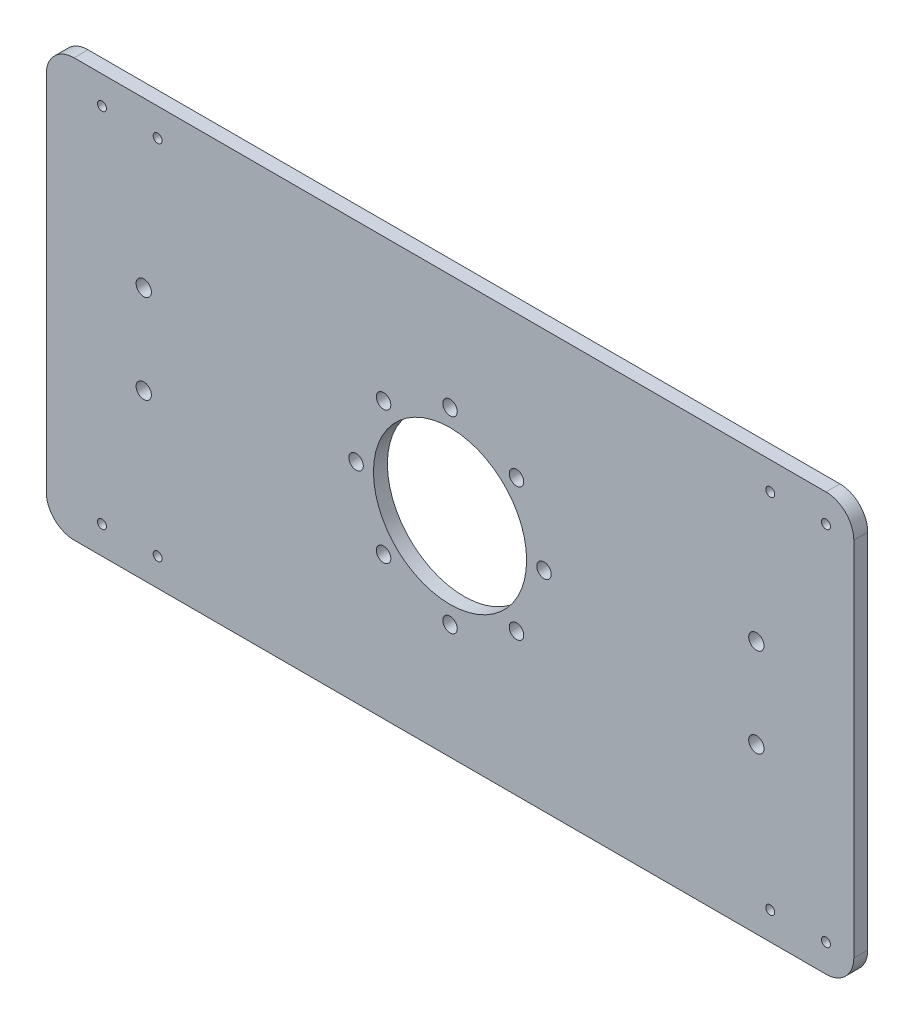
from build123d import *

# Parameters (mm, degrees)
SKETCH_1_W          = 290
SKETCH_1_H          = 150
EXTRUDE_1_DEPTH     = 5
CUT_EXTRUDE_2_REACH = 165.325
SKETCH_5_R          = 27.5
SKETCH_5_R_2        = 2.6
FILLET_1_R          = 10
SKETCH_6_R          = 2.75
CUT_EXTRUDE_3_DEPTH = 10
SKETCH_7_R          = 1.6
CUT_EXTRUDE_4_DEPTH = 10


with BuildPart() as part:
    # 草图1 → 凸台-拉伸1 (new body)
    with BuildSketch(Plane.XY):
        Rectangle(SKETCH_1_W, SKETCH_1_H)
    extrude(amount=EXTRUDE_1_DEPTH)

    # 草图5 → 切除-拉伸2 (cut, up to next)
    with BuildSketch(Plane(origin=(0, 0, 0), x_dir=(-1, 0, 0), z_dir=(0, 0, -1)), mode=Mode.PRIVATE) as cut_extrude_2_sk1:
        Circle(SKETCH_5_R)
    cut_extrude_2_tool1 = extrude(cut_extrude_2_sk1.sketch, amount=-CUT_EXTRUDE_2_REACH, mode=Mode.PRIVATE) & part.part
    # 草图5 → 切除-拉伸2 (cut, up to next)
    with BuildSketch(Plane(origin=(0, 0, 0), x_dir=(-1, 0, 0), z_dir=(0, 0, -1)), mode=Mode.PRIVATE) as cut_extrude_2_sk2:
        with Locations((23.864853865, 23.864853865)):
            Circle(SKETCH_5_R_2)
    cut_extrude_2_tool2 = extrude(cut_extrude_2_sk2.sketch, amount=-CUT_EXTRUDE_2_REACH, mode=Mode.PRIVATE) & part.part
    # 草图5 → 切除-拉伸2 (cut, up to next)
    with BuildSketch(Plane(origin=(0, 0, 0), x_dir=(-1, 0, 0), z_dir=(0, 0, -1)), mode=Mode.PRIVATE) as cut_extrude_2_sk3:
        with Locations((0, 33.75)):
            Circle(SKETCH_5_R_2)
    cut_extrude_2_tool3 = extrude(cut_extrude_2_sk3.sketch, amount=-CUT_EXTRUDE_2_REACH, mode=Mode.PRIVATE) & part.part
    # 草图5 → 切除-拉伸2 (cut, up to next)
    with BuildSketch(Plane(origin=(0, 0, 0), x_dir=(-1, 0, 0), z_dir=(0, 0, -1)), mode=Mode.PRIVATE) as cut_extrude_2_sk4:
        with Locations((-23.864853865, 23.864853865)):
            Circle(SKETCH_5_R_2)
    cut_extrude_2_tool4 = extrude(cut_extrude_2_sk4.sketch, amount=-CUT_EXTRUDE_2_REACH, mode=Mode.PRIVATE) & part.part
    # 草图5 → 切除-拉伸2 (cut, up to next)
    with BuildSketch(Plane(origin=(0, 0, 0), x_dir=(-1, 0, 0), z_dir=(0, 0, -1)), mode=Mode.PRIVATE) as cut_extrude_2_sk5:
        with Locations((-33.75, 0)):
            Circle(SKETCH_5_R_2)
    cut_extrude_2_tool5 = extrude(cut_extrude_2_sk5.sketch, amount=-CUT_EXTRUDE_2_REACH, mode=Mode.PRIVATE) & part.part
    # 草图5 → 切除-拉伸2 (cut, up to next)
    with BuildSketch(Plane(origin=(0, 0, 0), x_dir=(-1, 0, 0), z_dir=(0, 0, -1)), mode=Mode.PRIVATE) as cut_extrude_2_sk6:
        with Locations((-23.864853865, -23.864853865)):
            Circle(SKETCH_5_R_2)
    cut_extrude_2_tool6 = extrude(cut_extrude_2_sk6.sketch, amount=-CUT_EXTRUDE_2_REACH, mode=Mode.PRIVATE) & part.part
    # 草图5 → 切除-拉伸2 (cut, up to next)
    with BuildSketch(Plane(origin=(0, 0, 0), x_dir=(-1, 0, 0), z_dir=(0, 0, -1)), mode=Mode.PRIVATE) as cut_extrude_2_sk7:
        with Locations((0, -33.75)):
            Circle(SKETCH_5_R_2)
    cut_extrude_2_tool7 = extrude(cut_extrude_2_sk7.sketch, amount=-CUT_EXTRUDE_2_REACH, mode=Mode.PRIVATE) & part.part
    # 草图5 → 切除-拉伸2 (cut, up to next)
    with BuildSketch(Plane(origin=(0, 0, 0), x_dir=(-1, 0, 0), z_dir=(0, 0, -1)), mode=Mode.PRIVATE) as cut_extrude_2_sk8:
        with Locations((23.864853865, -23.864853865)):
            Circle(SKETCH_5_R_2)
    cut_extrude_2_tool8 = extrude(cut_extrude_2_sk8.sketch, amount=-CUT_EXTRUDE_2_REACH, mode=Mode.PRIVATE) & part.part
    # 草图5 → 切除-拉伸2 (cut, up to next)
    with BuildSketch(Plane(origin=(0, 0, 0), x_dir=(-1, 0, 0), z_dir=(0, 0, -1)), mode=Mode.PRIVATE) as cut_extrude_2_sk9:
        with Locations((33.75, 0)):
            Circle(SKETCH_5_R_2)
    cut_extrude_2_tool9 = extrude(cut_extrude_2_sk9.sketch, amount=-CUT_EXTRUDE_2_REACH, mode=Mode.PRIVATE) & part.part
    add(cut_extrude_2_tool1.solids().sort_by_distance((0, 0, 0))[0], mode=Mode.SUBTRACT)
    add(cut_extrude_2_tool2.solids().sort_by_distance((-23.864854, 23.864854, 0))[0], mode=Mode.SUBTRACT)
    add(cut_extrude_2_tool3.solids().sort_by_distance((0, 33.75, 0))[0], mode=Mode.SUBTRACT)
    add(cut_extrude_2_tool4.solids().sort_by_distance((23.864854, 23.864854, 0))[0], mode=Mode.SUBTRACT)
    add(cut_extrude_2_tool5.solids().sort_by_distance((33.75, 0, 0))[0], mode=Mode.SUBTRACT)
    add(cut_extrude_2_tool6.solids().sort_by_distance((23.864854, -23.864854, 0))[0], mode=Mode.SUBTRACT)
    add(cut_extrude_2_tool7.solids().sort_by_distance((0, -33.75, 0))[0], mode=Mode.SUBTRACT)
    add(cut_extrude_2_tool8.solids().sort_by_distance((-23.864854, -23.864854, 0))[0], mode=Mode.SUBTRACT)
    add(cut_extrude_2_tool9.solids().sort_by_distance((-33.75, 0, 0))[0], mode=Mode.SUBTRACT)

    # 圆角1
    fillet_1_edges = [part.edges().sort_by_distance(p)[0] for p in [
        (145, -75, 2.5),
        (-145, -75, 2.5),
        (-145, 75, 2.5),
        (145, 75, 2.5),
    ]]
    fillet(fillet_1_edges, radius=FILLET_1_R)

    # 草图6 → 切除-拉伸3 (cut)
    with BuildSketch(Plane(origin=(0, 0, 0), x_dir=(-1, 0, 0), z_dir=(0, 0, -1))):
        with Locations((110, -16)):
            Circle(SKETCH_6_R)
        with Locations((-110, -16)):
            Circle(SKETCH_6_R)
        with Locations((-110, 16)):
            Circle(SKETCH_6_R)
        with Locations((110, 16)):
            Circle(SKETCH_6_R)
    extrude(amount=-CUT_EXTRUDE_3_DEPTH, mode=Mode.SUBTRACT)

    # 草图7 → 切除-拉伸4 (cut)
    with BuildSketch(Plane(origin=(0, 0, 0), x_dir=(-1, 0, 0), z_dir=(0, 0, -1))):
        with Locations((-135, 65)):
            Circle(SKETCH_7_R)
        with Locations((-115, 65)):
            Circle(SKETCH_7_R)
        with Locations((105, 65)):
            Circle(SKETCH_7_R)
        with Locations((125, 65)):
            Circle(SKETCH_7_R)
        with Locations((105, -65)):
            Circle(SKETCH_7_R)
        with Locations((125, -65)):
            Circle(SKETCH_7_R)
        with Locations((-135, -65)):
            Circle(SKETCH_7_R)
        with Locations((-115, -65)):
            Circle(SKETCH_7_R)
    extrude(amount=-CUT_EXTRUDE_4_DEPTH, mode=Mode.SUBTRACT)


solid = part.part
